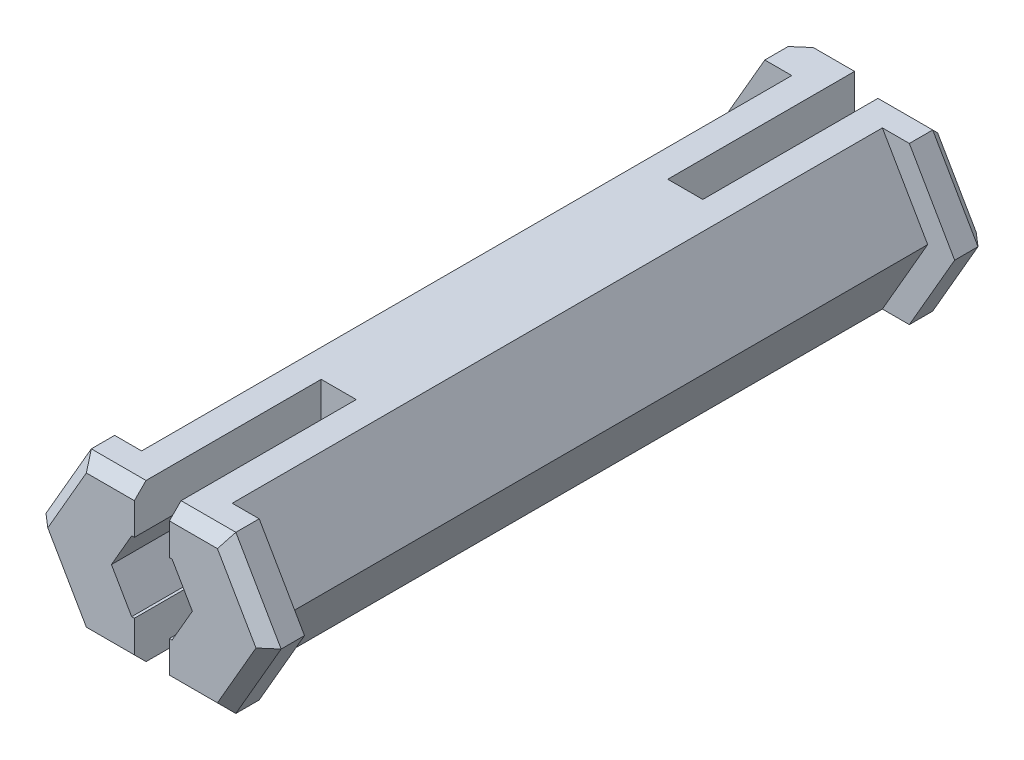
from build123d import *

# Parameters (mm, degrees)
BOSS_EXTRU_1_DEPTH      = 13.92
BOSS_EXTRU_2_DEPTH      = 1.5
ESQUISSE4_W             = 1.5
ESQUISSE4_H             = 0.855256697
ESQUISSE4_H_2           = 1.86
ESQUISSE4_H_3           = 3
ENL_V_MAT_EXTRU_1_DEPTH = 8
CHANFREIN1_SIZE         = 0.5


with BuildPart() as part:
    # Esquisse1 → Boss.-Extru.1 (new, symmetric)
    with BuildSketch(Plane(origin=(0, 0, 0), x_dir=(0, 1, 0), z_dir=(0, 0, 1))):
        Polygon((0, 3.879793809), (-3.36, 1.939896904), (-3.36, -1.939896904), (0, -3.879793809), (3.36, -1.939896904), (3.36, 1.939896904), align=None)
    extrude(amount=BOSS_EXTRU_1_DEPTH, both=True)

    # Esquisse2 → Boss.-Extru.2 (add)
    with BuildSketch(Plane.XY.offset(13.92)):
        Polygon((-1.939896904, 3.36), (-3.094597443, 3.36), (-5.034494347, 0), (-3.094597443, -3.36), (-1.939896904, -3.36), (-3.879793809, 0), align=None)
        Polygon((3.094597443, 3.36), (1.939896904, 3.36), (3.879793809, 0), (1.939896904, -3.36), (3.094597443, -3.36), (5.034494347, 0), align=None)
        Polygon((1.939896904, 3.36), (-1.939896904, 3.36), (-3.879793809, 0), (-1.939896904, -3.36), (1.939896904, -3.36), (3.879793809, 0), align=None)
    boss_extru_2 = extrude(amount=BOSS_EXTRU_2_DEPTH)

    # Esquisse4 → Enlèv. mat.-Extru.1 (cut)
    with BuildSketch(Plane.XY.offset(15.42)):
        with Locations((0, 3.787628349)):
            Rectangle(ESQUISSE4_W, ESQUISSE4_H)
        with Locations((0, 2.43)):
            Rectangle(ESQUISSE4_W, ESQUISSE4_H_2)
        Rectangle(ESQUISSE4_W, ESQUISSE4_H_3)
        with Locations((0, -2.43)):
            Rectangle(ESQUISSE4_W, ESQUISSE4_H_2)
        Polygon((0.75, 1.5), (0.75, -1.5), (0.866025404, -1.5), (1.732050808, 0), (0.866025404, 1.5), align=None)
        Polygon((-0.866025404, 1.5), (-1.732050808, 0), (-0.866025404, -1.5), (-0.75, -1.5), (-0.75, 1.5), align=None)
    enl_v_mat_extru_1 = extrude(amount=-ENL_V_MAT_EXTRU_1_DEPTH, mode=Mode.SUBTRACT)

    # Symétrie2: Boss.-Extru.2, Enlèv. mat.-Extru.1 across plane
    add(boss_extru_2.mirror(Plane.XY))
    add(enl_v_mat_extru_1.mirror(Plane.XY), mode=Mode.SUBTRACT)

    # Chanfrein1
    chanfrein1_edges = [part.edges().sort_by_distance(p)[0] for p in [
        (1.922298721, -3.36, -15.42),
        (1.922298721, 3.36, -15.42),
        (-1.922298721, 3.36, 15.42),
        (-1.922298721, -3.36, 15.42),
        (4.064545895, -1.68, 15.42),
        (4.064545895, 1.68, 15.42),
        (-4.064545895, 1.68, 15.42),
        (-4.064545895, -1.68, 15.42),
        (1.922298721, -3.36, 15.42),
        (1.922298721, 3.36, 15.42),
        (-4.064545895, -1.68, -15.42),
        (-4.064545895, 1.68, -15.42),
        (4.064545895, 1.68, -15.42),
        (4.064545895, -1.68, -15.42),
    ]]
    chamfer(chanfrein1_edges, length=CHANFREIN1_SIZE)


solid = part.part
